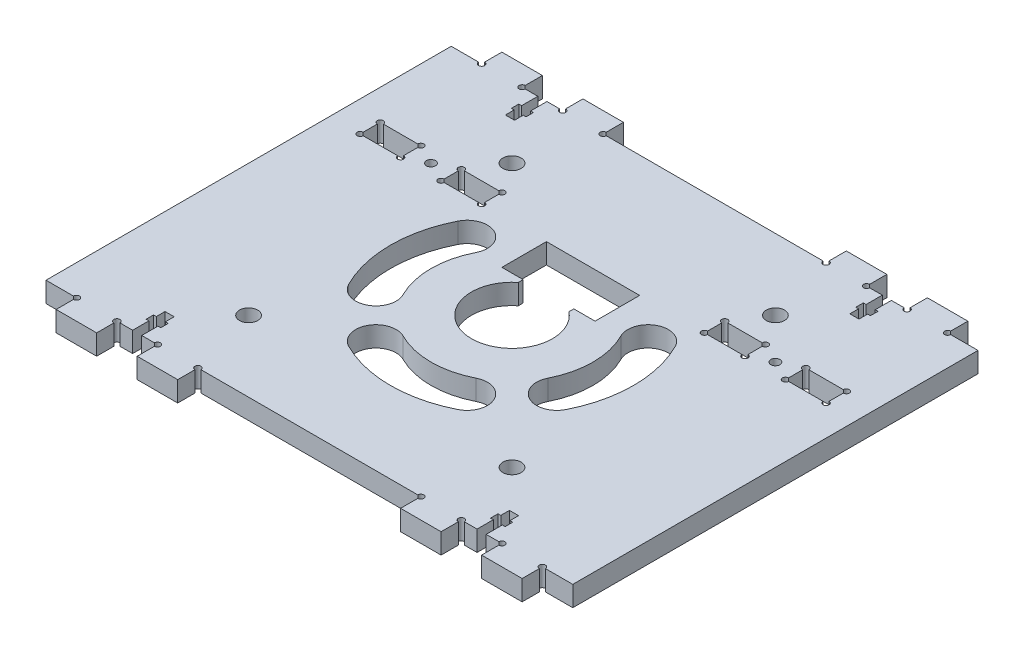
from build123d import *

# Parameters (mm, degrees)
SKETCH1_W            = 260
SKETCH1_H            = 200
EXTRUDE1_DEPTH       = 10
SKETCH3_W            = 20
SKETCH3_H            = 10
EXTRUDE2_DEPTH       = 10
M4_CLEARANCE_HOLE1_D = 4.5
EXTRUDE3_DEPTH       = 10
MIRROR2_COPY_1_DEPTH = 10
MIRROR3_COPY_1_DEPTH = 10
MIRROR3_COPY_2_DEPTH = 10
MIRROR3_COPY_3_DEPTH = 10
SKETCH7_W            = 20
SKETCH7_H            = 10
EXTRUDE4_DEPTH       = 10
LPATTERN1_COUNT      = 2
LPATTERN1_PITCH      = 170
LPATTERN1_COUNT_DIR2 = 2
LPATTERN1_PITCH_DIR2 = 210
EXTRUDE5_DEPTH       = 10
MIRROR5_COPY_1_DEPTH = 10
EXTRUDE6_DEPTH       = 10
MIRROR7_COPY_1_DEPTH = 10
EXTRUDE7_DEPTH       = 10
EXTRUDE8_DEPTH       = 10
M8_CLEARANCE_HOLE1_D = 9


with BuildPart() as part:
    # Sketch1 → Extrude1 (new body)
    with BuildSketch(Plane(origin=(0, 0, 0), x_dir=(1, 0, 0), z_dir=(0, 1, 0))):
        Rectangle(SKETCH1_W, SKETCH1_H)
    extrude(amount=EXTRUDE1_DEPTH)

    # Sketch3 → Extrude2 (cut)
    with BuildSketch(Plane(origin=(0, 10, 0), x_dir=(1, 0, 0), z_dir=(0, 1, 0))):
        with Locations((-105, 45)):
            Rectangle(SKETCH3_W, SKETCH3_H)
        with Locations((105, 45)):
            Rectangle(SKETCH3_W, SKETCH3_H)
        with Locations((-65, 45)):
            Rectangle(SKETCH3_W, SKETCH3_H)
        with Locations((65, 45)):
            Rectangle(SKETCH3_W, SKETCH3_H)
    extrude(amount=-EXTRUDE2_DEPTH, mode=Mode.SUBTRACT)

    # M4 Clearance Hole1 (through all)
    with Locations(Plane(origin=(0, 10, 0), x_dir=(1, 0, 0), z_dir=(0, 1, 0))):
        with Locations((-85, 45), (85, 45)):
            Hole(M4_CLEARANCE_HOLE1_D / 2)

    # Sketch6 → Extrude3 (cut)
    with BuildSketch(Plane(origin=(0, 10, 0), x_dir=(1, 0, 0), z_dir=(0, 1, 0))):
        with BuildLine():
            Line((-113.5, 50), (-115, 50))
            Line((-115, 50), (-115, 48.5))
            ThreePointArc((-115, 48.5), (-116.060660172, 51.060660172), (-113.5, 50))
        make_face()
        with BuildLine():
            Line((-113.5, 40), (-115, 40))
            Line((-115, 40), (-115, 41.5))
            ThreePointArc((-115, 41.5), (-116.060660172, 38.939339828), (-113.5, 40))
        make_face()
    extrude3 = extrude(amount=-EXTRUDE3_DEPTH, mode=Mode.SUBTRACT)

    # Mirror1: Extrude3 across plane
    add(extrude3.mirror(Plane(origin=(-105, 0, 0), x_dir=(0, 0, 1), z_dir=(1, 0, 0))), mode=Mode.SUBTRACT)

    # Mirror2: Extrude3 across plane
    add(extrude3.mirror(Plane.ZY.offset(85)), mode=Mode.SUBTRACT)

    # Mirror2 copy 1 sketch → Mirror2 copy 1 (cut)
    with BuildSketch(Plane(origin=(40, 10, 0), x_dir=(1, 0, 0), z_dir=(0, 1, 0))):
        with BuildLine():
            Line((-113.5, 50), (-115, 50))
            Line((-115, 50), (-115, 48.5))
            ThreePointArc((-115, 48.5), (-116.060660172, 51.060660172), (-113.5, 50))
        make_face()
        with BuildLine():
            Line((-113.5, 40), (-115, 40))
            Line((-115, 40), (-115, 41.5))
            ThreePointArc((-115, 41.5), (-116.060660172, 38.939339828), (-113.5, 40))
        make_face()
    extrude(amount=-MIRROR2_COPY_1_DEPTH, mode=Mode.SUBTRACT)

    # Mirror3: Extrude3 across plane
    add(extrude3.mirror(Plane(origin=(0, 0, 0), x_dir=(0, 0, 1), z_dir=(1, 0, 0))), mode=Mode.SUBTRACT)

    # Mirror3 copy 1 sketch → Mirror3 copy 1 (cut)
    with BuildSketch(Plane(origin=(210, 10, 0), x_dir=(1, 0, 0), z_dir=(0, 1, 0))):
        with BuildLine():
            Line((-113.5, 50), (-115, 50))
            Line((-115, 50), (-115, 48.5))
            ThreePointArc((-115, 48.5), (-116.060660172, 51.060660172), (-113.5, 50))
        make_face()
        with BuildLine():
            Line((-113.5, 40), (-115, 40))
            Line((-115, 40), (-115, 41.5))
            ThreePointArc((-115, 41.5), (-116.060660172, 38.939339828), (-113.5, 40))
        make_face()
    extrude(amount=-MIRROR3_COPY_1_DEPTH, mode=Mode.SUBTRACT)

    # Mirror3 copy 2 sketch → Mirror3 copy 2 (cut)
    with BuildSketch(Plane(origin=(170, 10, 0), x_dir=(1, 0, 0), z_dir=(0, 1, 0))):
        with BuildLine():
            Line((-113.5, 50), (-115, 50))
            Line((-115, 50), (-115, 48.5))
            ThreePointArc((-115, 48.5), (-116.060660172, 51.060660172), (-113.5, 50))
        make_face()
        with BuildLine():
            Line((-113.5, 40), (-115, 40))
            Line((-115, 40), (-115, 41.5))
            ThreePointArc((-115, 41.5), (-116.060660172, 38.939339828), (-113.5, 40))
        make_face()
    extrude(amount=-MIRROR3_COPY_2_DEPTH, mode=Mode.SUBTRACT)

    # Mirror3 copy 3 sketch → Mirror3 copy 3 (cut)
    with BuildSketch(Plane(origin=(-40, 10, 0), x_dir=(-1, 0, 0), z_dir=(0, 1, 0))):
        with BuildLine():
            Line((-113.5, -50), (-115, -50))
            Line((-115, -50), (-115, -48.5))
            ThreePointArc((-115, -48.5), (-116.060660172, -51.060660172), (-113.5, -50))
        make_face()
        with BuildLine():
            Line((-113.5, -40), (-115, -40))
            Line((-115, -40), (-115, -41.5))
            ThreePointArc((-115, -41.5), (-116.060660172, -38.939339828), (-113.5, -40))
        make_face()
    extrude(amount=-MIRROR3_COPY_3_DEPTH, mode=Mode.SUBTRACT)

    # Sketch7 → Extrude4 (add)
    with BuildSketch(Plane(origin=(0, 10, 0), x_dir=(1, 0, 0), z_dir=(0, 1, 0))):
        with Locations((-105, -105)):
            Rectangle(SKETCH7_W, SKETCH7_H)
        with Locations((-65, -105)):
            Rectangle(SKETCH7_W, SKETCH7_H)
    extrude4 = extrude(amount=-EXTRUDE4_DEPTH)

    # LPattern1: Extrude4 2 × 2
    with Locations(*[(i * LPATTERN1_PITCH, 0, -j * LPATTERN1_PITCH_DIR2) for i in range(LPATTERN1_COUNT) for j in range(LPATTERN1_COUNT_DIR2) if (i, j) != (0, 0)]):
        add(extrude4)

    # Sketch8 → Extrude5 (cut)
    with BuildSketch(Plane(origin=(0, 10, 0), x_dir=(1, 0, 0), z_dir=(0, 1, 0))):
        with BuildLine():
            Line((-116.5, -100), (-115, -100))
            Line((-115, -100), (-115, -101.5))
            ThreePointArc((-115, -101.5), (-113.939339828, -98.939339828), (-116.5, -100))
        make_face()
        with BuildLine():
            Line((-95, -101.5), (-95, -100))
            Line((-95, -100), (-93.5, -100))
            ThreePointArc((-93.5, -100), (-96.060660172, -98.939339828), (-95, -101.5))
        make_face()
        with BuildLine():
            Line((-75, -100), (-75, -101.5))
            ThreePointArc((-75, -101.5), (-73.939339828, -98.939339828), (-76.5, -100))
            Line((-76.5, -100), (-75, -100))
        make_face()
        with BuildLine():
            Line((-55, -101.5), (-55, -100))
            Line((-55, -100), (-53.5, -100))
            ThreePointArc((-53.5, -100), (-56.060660172, -98.939339828), (-55, -101.5))
        make_face()
    extrude5 = extrude(amount=-EXTRUDE5_DEPTH, mode=Mode.SUBTRACT)

    # Mirror4: Extrude5 across plane
    add(extrude5.mirror(Plane(origin=(0, 0, 0), x_dir=(0, 0, 1), z_dir=(1, 0, 0))), mode=Mode.SUBTRACT)

    # Mirror5: Extrude5 across plane
    add(extrude5.mirror(Plane.XY), mode=Mode.SUBTRACT)

    # Mirror5 copy 1 sketch → Mirror5 copy 1 (cut)
    with BuildSketch(Plane(origin=(0, 10, 0), x_dir=(-1, 0, 0), z_dir=(0, 1, 0))):
        with BuildLine():
            Line((-116.5, -100), (-115, -100))
            Line((-115, -100), (-115, -101.5))
            ThreePointArc((-115, -101.5), (-113.939339828, -98.939339828), (-116.5, -100))
        make_face()
        with BuildLine():
            Line((-95, -101.5), (-95, -100))
            Line((-95, -100), (-93.5, -100))
            ThreePointArc((-93.5, -100), (-96.060660172, -98.939339828), (-95, -101.5))
        make_face()
        with BuildLine():
            Line((-75, -100), (-75, -101.5))
            ThreePointArc((-75, -101.5), (-73.939339828, -98.939339828), (-76.5, -100))
            Line((-76.5, -100), (-75, -100))
        make_face()
        with BuildLine():
            Line((-55, -101.5), (-55, -100))
            Line((-55, -100), (-53.5, -100))
            ThreePointArc((-53.5, -100), (-56.060660172, -98.939339828), (-55, -101.5))
        make_face()
    extrude(amount=-MIRROR5_COPY_1_DEPTH, mode=Mode.SUBTRACT)

    # Sketch9 → Extrude6 (cut)
    with BuildSketch(Plane(origin=(0, 10, 0), x_dir=(1, 0, 0), z_dir=(0, 1, 0))):
        Polygon((-87.25, -100), (-87.25, -92), (-88.625, -92), (-88.625, -88.3), (-87.25, -88.3), (-87.25, -84), (-82.75, -84), (-82.75, -88.3), (-81.375, -88.3), (-81.375, -92), (-82.75, -92), (-82.75, -100), align=None)
    extrude6 = extrude(amount=-EXTRUDE6_DEPTH, mode=Mode.SUBTRACT)

    # Mirror6: Extrude6 across plane
    add(extrude6.mirror(Plane(origin=(0, 0, 0), x_dir=(0, 0, 1), z_dir=(1, 0, 0))), mode=Mode.SUBTRACT)

    # Mirror7: Extrude6 across plane
    add(extrude6.mirror(Plane.XY), mode=Mode.SUBTRACT)

    # Mirror7 copy 1 sketch → Mirror7 copy 1 (cut)
    with BuildSketch(Plane(origin=(0, 10, 0), x_dir=(-1, 0, 0), z_dir=(0, 1, 0))):
        Polygon((-87.25, -100), (-87.25, -92), (-88.625, -92), (-88.625, -88.3), (-87.25, -88.3), (-87.25, -84), (-82.75, -84), (-82.75, -88.3), (-81.375, -88.3), (-81.375, -92), (-82.75, -92), (-82.75, -100), align=None)
    extrude(amount=-MIRROR7_COPY_1_DEPTH, mode=Mode.SUBTRACT)

    # Sketch10 → Extrude7 (cut)
    with BuildSketch(Plane(origin=(0, 10, 0), x_dir=(1, 0, 0), z_dir=(0, 1, 0))):
        with BuildLine():
            Line((-23, 40), (23, 40))
            Line((23, 40), (23, 18))
            Line((23, 18), (12.5, 18))
            Line((12.5, 18), (12.5, 15.612494996))
            ThreePointArc((12.5, 15.612494996), (0, -20), (-12.5, 15.612494996))
            Line((-12.5, 15.612494996), (-12.5, 18))
            Line((-12.5, 18), (-23, 18))
            Line((-23, 18), (-23, 40))
        make_face()
    extrude(amount=-EXTRUDE7_DEPTH, mode=Mode.SUBTRACT)

    # Sketch11 → Extrude8 (cut)
    with BuildSketch(Plane(origin=(0, 10, 0), x_dir=(1, 0, 0), z_dir=(0, 1, 0))):
        with BuildLine():
            ThreePointArc((53.581713298, -27), (60, 0), (53.581713298, 27))
            ThreePointArc((53.581713298, 27), (40.151427749, 31.43028555), (35.721142199, 18))
            ThreePointArc((35.721142199, 18), (40, 0), (35.721142199, -18))
            ThreePointArc((35.721142199, -18), (40.151427749, -31.43028555), (53.581713298, -27))
        make_face()
        with BuildLine():
            ThreePointArc((-27, -53.581713298), (0, -60), (27, -53.581713298))
            ThreePointArc((27, -53.581713298), (31.43028555, -40.151427749), (18, -35.721142199))
            ThreePointArc((18, -35.721142199), (0, -40), (-18, -35.721142199))
            ThreePointArc((-18, -35.721142199), (-31.43028555, -40.151427749), (-27, -53.581713298))
        make_face()
        with BuildLine():
            ThreePointArc((-53.581713298, 27), (-60, 0), (-53.581713298, -27))
            ThreePointArc((-53.581713298, -27), (-40.151427749, -31.43028555), (-35.721142199, -18))
            ThreePointArc((-35.721142199, -18), (-40, 0), (-35.721142199, 18))
            ThreePointArc((-35.721142199, 18), (-40.151427749, 31.43028555), (-53.581713298, 27))
        make_face()
    extrude(amount=-EXTRUDE8_DEPTH, mode=Mode.SUBTRACT)

    # M8 Clearance Hole1 (through all)
    with Locations(Plane(origin=(0, 10, 0), x_dir=(1, 0, 0), z_dir=(0, 1, 0))):
        with Locations((-65, -65), (65, -65), (65, 65), (-65, 65)):
            Hole(M8_CLEARANCE_HOLE1_D / 2)


solid = part.part
